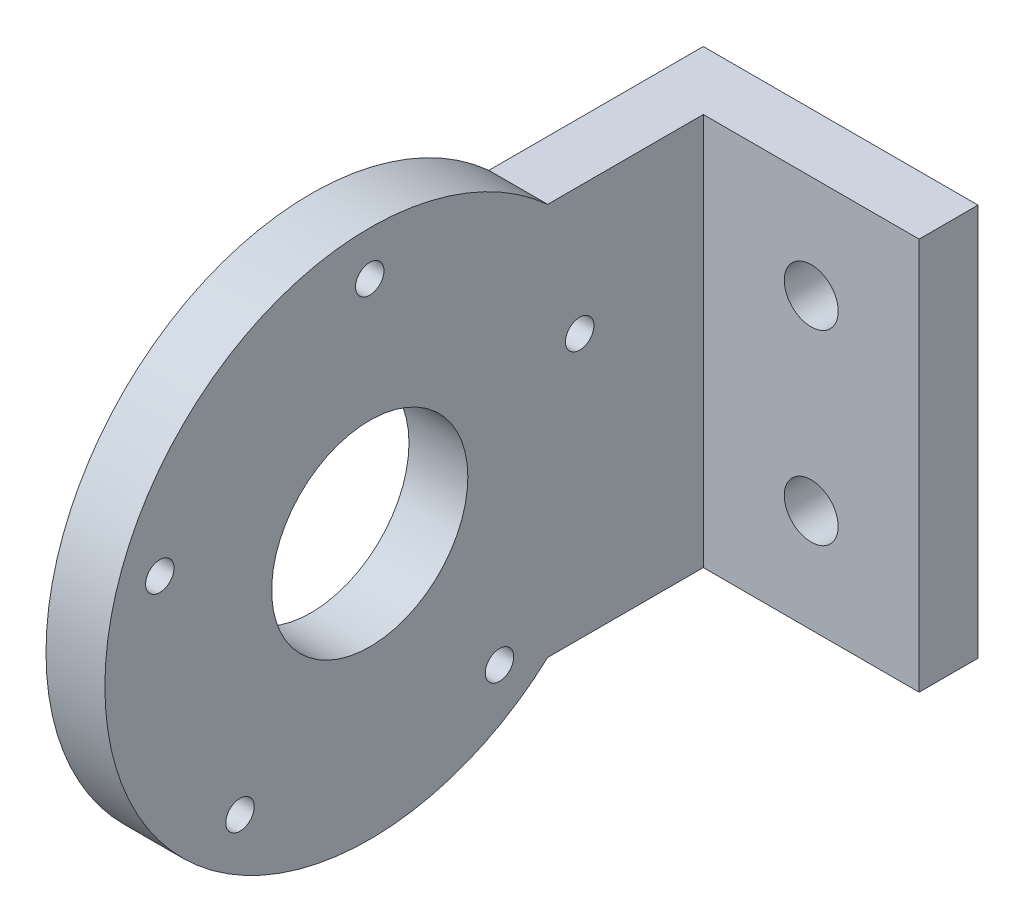
from build123d import *

# Parameters (mm, degrees)
SKETCH1_R           = 27
BOSS_EXTRUDE1_DEPTH = 6
SKETCH2_W           = 25
SKETCH2_H           = 40
BOSS_EXTRUDE2_DEPTH = 6
SKETCH3_R           = 10
SKETCH3_R_2         = 1.45
CUT_EXTRUDE1_DEPTH  = 6
SKETCH4_W           = 22.01
SKETCH4_H           = 40
SKETCH4_R           = 2.75
BOSS_EXTRUDE3_DEPTH = 6


with BuildPart() as part:
    # Sketch1 → Boss-Extrude1 (new body)
    with BuildSketch(Plane(origin=(221, 0, 0), x_dir=(0, 0, -1), z_dir=(1, 0, 0))):
        with Locations((-300, 300)):
            Circle(SKETCH1_R)
    extrude(amount=BOSS_EXTRUDE1_DEPTH)

    # Sketch2 → Boss-Extrude2 (add)
    with BuildSketch(Plane(origin=(221, 0, 0), x_dir=(0, 0, -1), z_dir=(1, 0, 0))):
        with Locations((-272.5, 300)):
            Rectangle(SKETCH2_W, SKETCH2_H)
    extrude(amount=BOSS_EXTRUDE2_DEPTH)

    # Sketch3 → Cut-Extrude1 (cut)
    with BuildSketch(Plane(origin=(221, 0, 0), x_dir=(0, 0, -1), z_dir=(1, 0, 0))):
        with Locations((-300, 300)):
            Circle(SKETCH3_R)
        with Locations((-300, 322.5)):
            Circle(SKETCH3_R_2)
        with Locations((-278.601228383, 306.952882373)):
            Circle(SKETCH3_R_2)
        with Locations((-286.774831823, 281.797117627)):
            Circle(SKETCH3_R_2)
        with Locations((-313.225168177, 281.797117627)):
            Circle(SKETCH3_R_2)
        with Locations((-321.398771617, 306.952882373)):
            Circle(SKETCH3_R_2)
    extrude(amount=CUT_EXTRUDE1_DEPTH, mode=Mode.SUBTRACT)

    # Sketch4 → Boss-Extrude3 (add)
    with BuildSketch(Plane.XY.offset(260)):
        with Locations((237.995, 300)):
            Rectangle(SKETCH4_W, SKETCH4_H)
        with Locations((238, 290.5)):
            Circle(SKETCH4_R, mode=Mode.SUBTRACT)
        with Locations((238, 309.5)):
            Circle(SKETCH4_R, mode=Mode.SUBTRACT)
    extrude(amount=BOSS_EXTRUDE3_DEPTH)


solid = part.part
